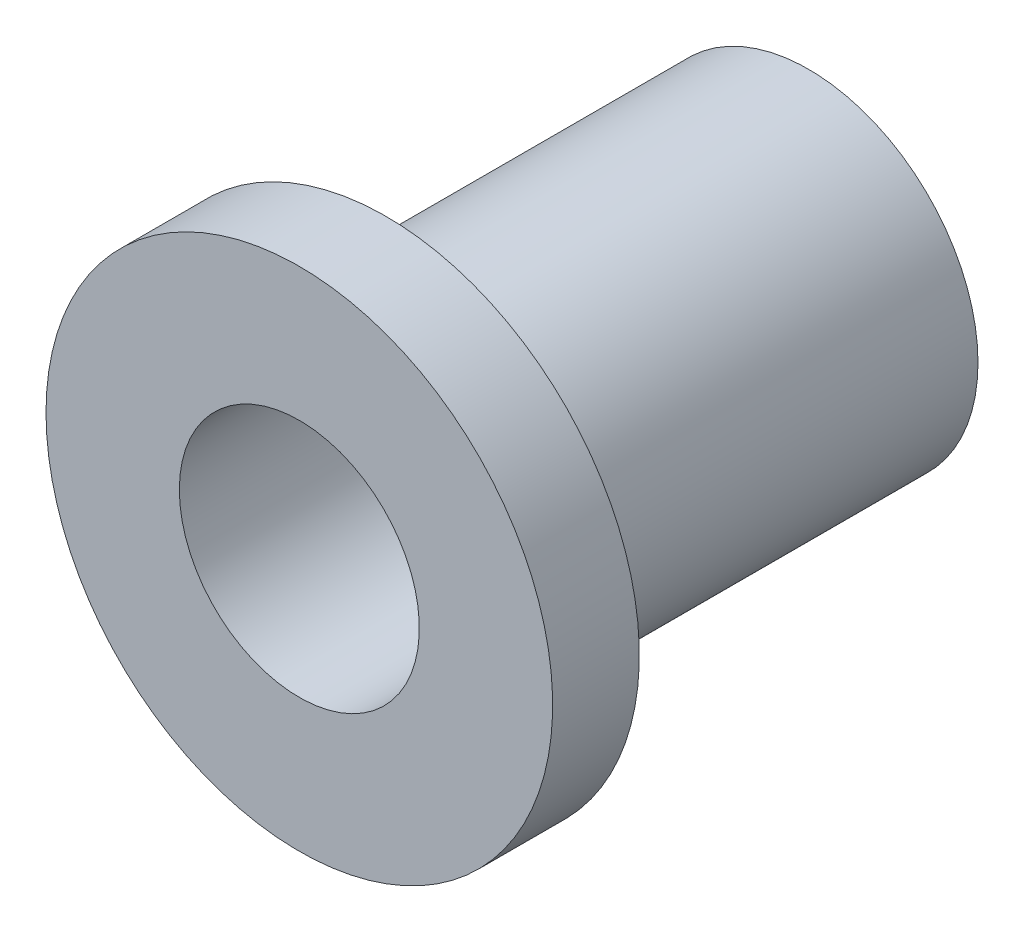
from build123d import *

# Parameters (mm, degrees)
SKETCH_1_R      = 9.5
SKETCH_1_R_2    = 4.5
EXTRUDE_1_DEPTH = 3.25
EXTRUDE_START   = 15.85
SKETCH_2_R      = 6.35
SKETCH_2_R_2    = 4.5
EXTRUDE_2_DEPTH = 15.85


with BuildPart() as part:
    # Эскиз1 → Бобышка-Вытянуть1 (new body)
    with BuildSketch(Plane.XY):
        with Locations(Location((0, 0, 0), (0, 0, 180))):
            Circle(SKETCH_1_R)
        with Locations(Location((0, 0, 0), (0, 0, 180))):
            Circle(SKETCH_1_R_2, mode=Mode.SUBTRACT)
    extrude(amount=EXTRUDE_1_DEPTH)

    # Эскиз2 → Бобышка-Вытянуть2 (add)
    with BuildSketch(Plane(origin=(0, 0, 0), x_dir=(-1, 0, 0), z_dir=(0, 0, -1)).offset(EXTRUDE_START)):
        with Locations(Location((0, 0, 0), (0, 0, 180))):
            Circle(SKETCH_2_R)
        Circle(SKETCH_2_R_2, mode=Mode.SUBTRACT)
    extrude(amount=-EXTRUDE_2_DEPTH)


solid = part.part
